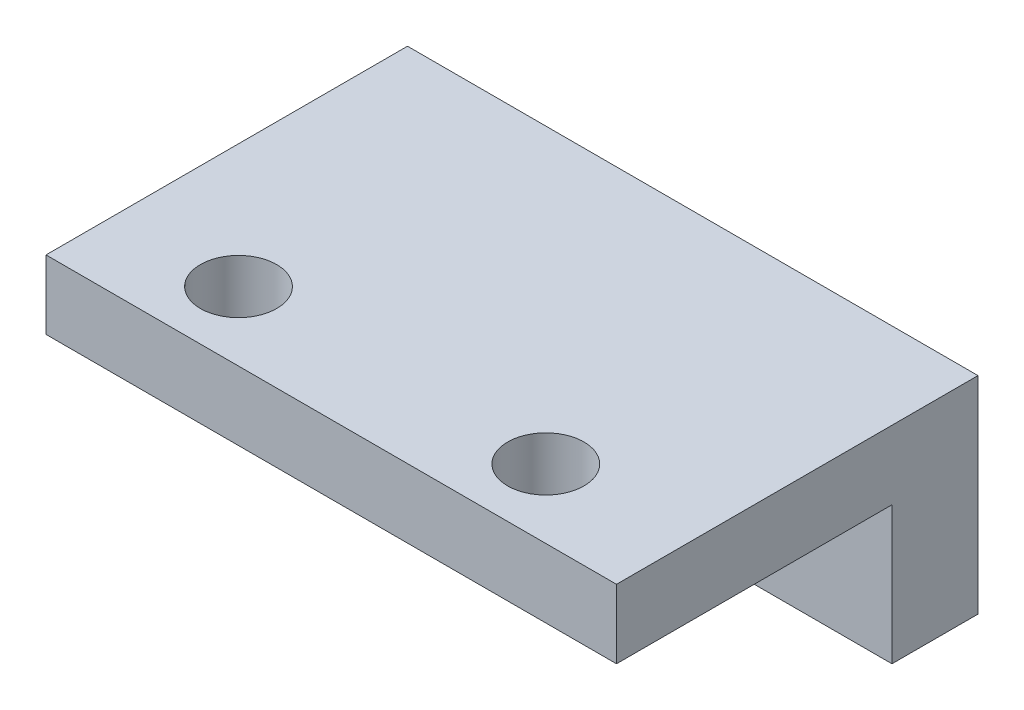
from build123d import *

# Parameters (mm, degrees)
SKETCH1_R           = 2
BOSS_EXTRUDE1_DEPTH = 20
SKETCH2_W           = 31.562668847
SKETCH2_H           = 7.62
CUT_EXTRUDE1_DEPTH  = 15.24
SKETCH5_R           = 2.11
CUT_EXTRUDE2_DEPTH  = 10.414


with BuildPart() as part:
    # Sketch1 → Boss-Extrude1 (new body)
    with BuildSketch(Plane.XY):
        Polygon((-16.147505616, -28.306513497), (-16.147505616, -35.926513497), (-47.710174463, -35.926513497), (-47.710174463, -28.306513497), (-47.710174463, -24.496513497), (-16.147505616, -24.496513497), align=None)
        with Locations((-40.868568225, -32.116513497)):
            Circle(SKETCH1_R, mode=Mode.SUBTRACT)
        with Locations((-23.868568225, -32.116530453)):
            Circle(SKETCH1_R, mode=Mode.SUBTRACT)
    extrude(amount=BOSS_EXTRUDE1_DEPTH)

    # Sketch2 → Cut-Extrude1 (cut)
    with BuildSketch(Plane.XY.offset(20)):
        with Locations((-31.92884004, -32.116513497)):
            Rectangle(SKETCH2_W, SKETCH2_H)
    extrude(amount=-CUT_EXTRUDE1_DEPTH, mode=Mode.SUBTRACT)

    # Sketch5 → Cut-Extrude2 (cut)
    with BuildSketch(Plane(origin=(0, -24.496513497, 0), x_dir=(1, 0, 0), z_dir=(0, 1, 0))):
        with Locations(Location((-23.868568225, -16.19, 0), (0, 0, 270))):
            Circle(SKETCH5_R)
        with Locations(Location((-40.868568225, -16.19, 0), (0, 0, 270))):
            Circle(SKETCH5_R)
    extrude(amount=-CUT_EXTRUDE2_DEPTH, mode=Mode.SUBTRACT)


solid = part.part
